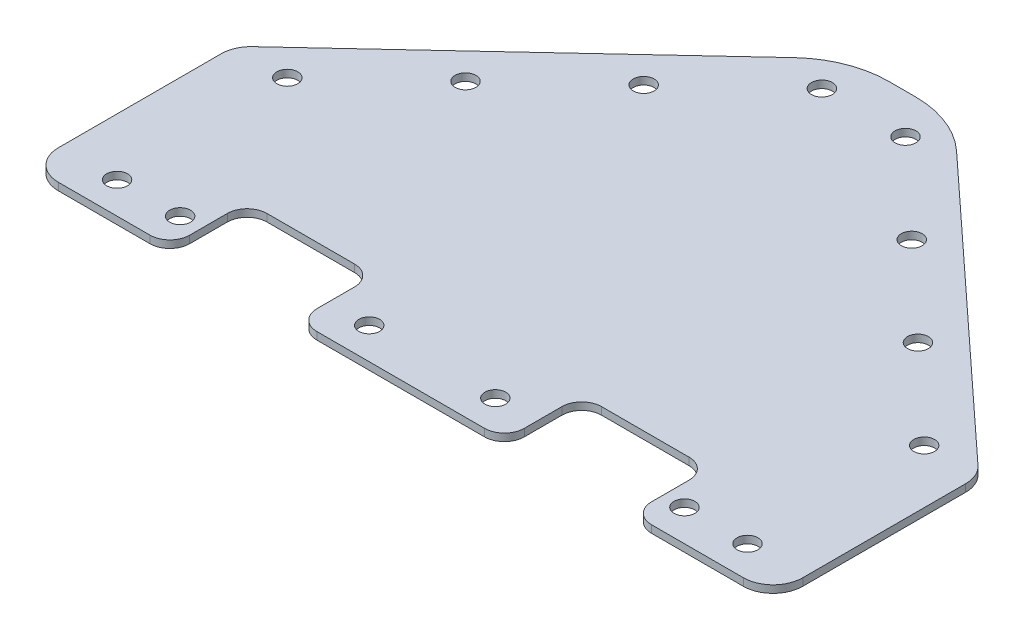
from build123d import *

# Parameters (mm, degrees)
SKETCH_1_R          = 2.0955
EXTRUDE_1_DEPTH     = 1.5
SKETCH_2_R          = 2.1
CUT_EXTRUDE_1_DEPTH = 1.5
FILLET_1_R          = 6
CUT_EXTRUDE_START   = -1.5
SKETCH_3_W          = 25.639754975
SKETCH_3_H          = 15.572778706
SKETCH_3_R          = 2.0955
CUT_EXTRUDE_3_DEPTH = 1.5
FILLET_2_R          = 4


with BuildPart() as part:
    # 草图1 → 凸台-拉伸1 (new body)
    with BuildSketch(Plane(origin=(0, 0, 0), x_dir=(1, 0, 0), z_dir=(0, 1, 0))):
        with BuildLine():
            Line((-105.503818672, 6.037520304), (-105.503818672, -35.395112744))
            Line((-105.503818672, -35.395112744), (44.496181328, -35.395112744))
            Line((44.496181328, -35.395112744), (44.496181328, 6.037520304))
            Line((44.496181328, 6.037520304), (-14.469645921, 60.536135507))
            ThreePointArc((-14.469645921, 60.536135507), (-20.755816559, 64.47318161), (-28.044474141, 65.848588442))
            Line((-28.044474141, 65.848588442), (-33.461010911, 65.848588442))
            ThreePointArc((-33.461010911, 65.848588442), (-40.789042153, 64.457724857), (-47.097844214, 60.478584254))
            Line((-47.097844214, 60.478584254), (-105.503818672, 6.037520304))
        make_face()
        with Locations(Location((-94.003818672, -29.045112744, 0), (0, 0, 270))):
            Circle(SKETCH_1_R, mode=Mode.SUBTRACT)
        with Locations(Location((32.996181328, -29.045112744, 0), (0, 0, 270))):
            Circle(SKETCH_1_R, mode=Mode.SUBTRACT)
        with Locations(Location((-68.603818672, -29.045112744, 0), (0, 0, 270))):
            Circle(SKETCH_1_R, mode=Mode.SUBTRACT)
        with Locations(Location((-43.203818672, -29.045112744, 0), (0, 0, 270))):
            Circle(SKETCH_1_R, mode=Mode.SUBTRACT)
        with Locations(Location((-17.803818672, -29.045112744, 0), (0, 0, 270))):
            Circle(SKETCH_1_R, mode=Mode.SUBTRACT)
        with Locations(Location((7.596181328, -29.045112744, 0), (0, 0, 270))):
            Circle(SKETCH_1_R, mode=Mode.SUBTRACT)
    extrude(amount=EXTRUDE_1_DEPTH)

    # 草图2 → 切除-拉伸1 (cut)
    with BuildSketch(Plane(origin=(0, 1.5, 0), x_dir=(1, 0, 0), z_dir=(0, 1, 0))):
        with Locations(Location((-81.303818672, -29.045112744, 0), (0, 0, 270))):
            Circle(SKETCH_2_R)
        with Locations(Location((20.296181328, -29.045112744, 0), (0, 0, 270))):
            Circle(SKETCH_2_R)
        with Locations(Location((-94.655027928, 5.896929075, 0), (0, 0, 270))):
            Circle(SKETCH_2_R)
        with Locations(Location((-76.078643907, 23.219687421, 0), (0, 0, 270))):
            Circle(SKETCH_2_R)
        with Locations(Location((-57.502259886, 40.542445766, 0), (0, 0, 270))):
            Circle(SKETCH_2_R)
        with Locations(Location((-38.925875865, 57.865204112, 0), (0, 0, 270))):
            Circle(SKETCH_2_R)
        with Locations(Location((33.647390585, 5.896929075, 0), (0, 0, 90))):
            Circle(SKETCH_2_R)
        with Locations(Location((15.071006563, 23.219687421, 0), (0, 0, 90))):
            Circle(SKETCH_2_R)
        with Locations(Location((-3.505377458, 40.542445766, 0), (0, 0, 90))):
            Circle(SKETCH_2_R)
        with Locations(Location((-22.081761479, 57.865204112, 0), (0, 0, 90))):
            Circle(SKETCH_2_R)
    extrude(amount=-CUT_EXTRUDE_1_DEPTH, mode=Mode.SUBTRACT)

    # 圆角1
    fillet_1_edges = [part.edges().sort_by_distance(p)[0] for p in [
        (44.496181328, 0.75, -6.037520304),
        (44.496181328, 0.75, 35.395112744),
        (-105.503818672, 0.75, 35.395112744),
        (-105.503818672, 0.75, -6.037520304),
    ]]
    fillet(fillet_1_edges, radius=FILLET_1_R)

    # 草图3 → 切除-拉伸3 (cut)
    # profile 1 of 2: a face of its own
    with BuildSketch(Plane(origin=(0, 1.5, 0), x_dir=(1, 0, 0), z_dir=(0, 1, 0)).offset(CUT_EXTRUDE_START)):
        with Locations((-64.205559978, -27.608723391)):
            Rectangle(SKETCH_3_W, SKETCH_3_H)
        with Locations((-68.603818672, -29.045112744)):
            Circle(SKETCH_3_R, mode=Mode.SUBTRACT)
    # profile 2 of 2: a face of its own
    with BuildSketch(Plane(origin=(0, 1.5, 0), x_dir=(1, 0, 0), z_dir=(0, 1, 0)).offset(CUT_EXTRUDE_START)):
        with Locations((3.197922635, -27.608723391)):
            Rectangle(SKETCH_3_W, SKETCH_3_H)
        with Locations((7.596181328, -29.045112744)):
            Circle(SKETCH_3_R, mode=Mode.SUBTRACT)
    extrude(amount=CUT_EXTRUDE_3_DEPTH, mode=Mode.SUBTRACT)

    # 圆角2
    fillet_2_edges = [part.edges().sort_by_distance(p)[0] for p in [
        (-51.38568249, 0.75, 35.395112744),
        (-77.025437465, 0.75, 35.395112744),
        (-77.025437465, 0.75, 19.822334038),
        (-51.38568249, 0.75, 19.822334038),
        (16.017800122, 0.75, 35.395112744),
        (-9.621954853, 0.75, 35.395112744),
        (-9.621954853, 0.75, 19.822334038),
        (16.017800122, 0.75, 19.822334038),
    ]]
    fillet(fillet_2_edges, radius=FILLET_2_R)


solid = part.part
